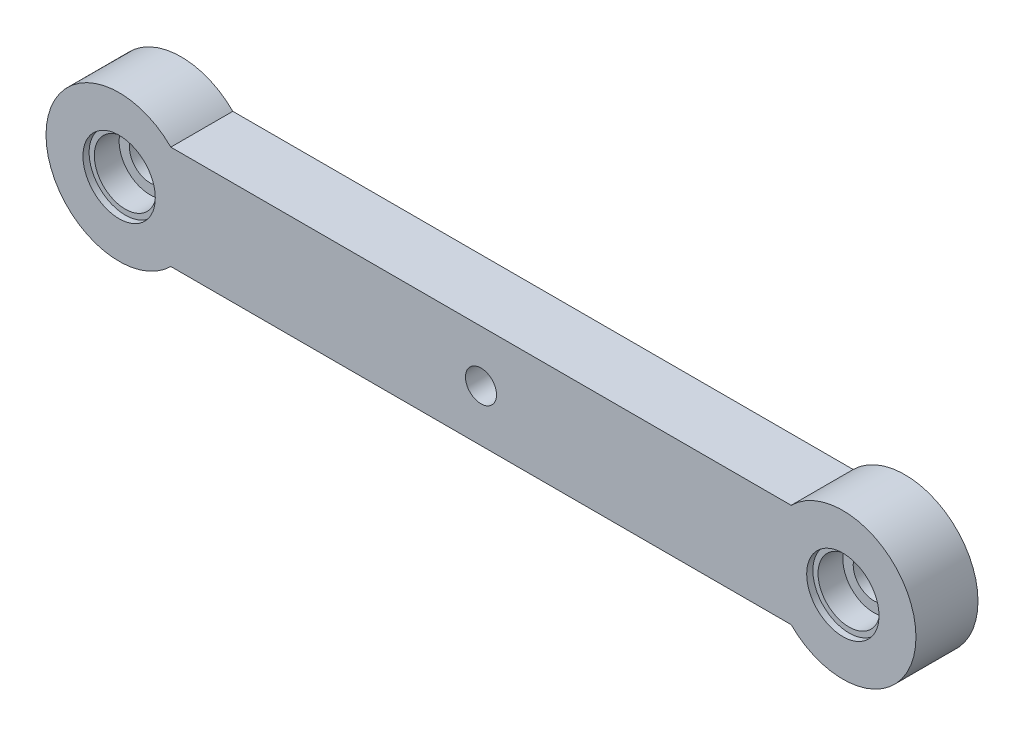
from build123d import *

# Parameters (mm, degrees)
SKETCH1_R               = 7.071067812
SKETCH1_R_2             = 3
SKETCH1_W               = 80
SKETCH1_H               = 10
BOSS_EXTRUDE1_DEPTH     = 6
SKETCH2_R               = 3
CUT_EXTRUDE1_DEPTH      = 3
SKETCH3_R               = 2
CUT_EXTRUDE2_DEPTH      = 44.081025369
SKETCH4_R               = 3.5
CUT_EXTRUDE3_DEPTH      = 0.6
CUT_EXTRUDE4_DEPTH      = 24
CUT_EXTRUDE4_DEPTH_BACK = 44.081025369
SKETCH5_R               = 1.5


with BuildPart() as part:
    # Sketch1 → Boss-Extrude1 (new body)
    with BuildSketch(Plane.XY):
        with Locations((-35, 0)):
            Circle(SKETCH1_R)
        with Locations((-35, 0)):
            Circle(SKETCH1_R_2)
        with Locations((35, 0)):
            Circle(SKETCH1_R)
        with Locations((35, 0)):
            Circle(SKETCH1_R_2)
        Rectangle(SKETCH1_W, SKETCH1_H)
    extrude(amount=BOSS_EXTRUDE1_DEPTH)

    # Sketch2 → Cut-Extrude1 (cut)
    with BuildSketch(Plane.XY.offset(6)):
        with Locations((-35, 0)):
            Circle(SKETCH2_R)
        with Locations((35, 0)):
            Circle(SKETCH2_R)
    extrude(amount=-CUT_EXTRUDE1_DEPTH, mode=Mode.SUBTRACT)

    # Sketch3 → Cut-Extrude2 (cut, through all)
    with BuildSketch(Plane.XY.offset(6)):
        with Locations((-35, 0)):
            Circle(SKETCH3_R)
        with Locations((35, 0)):
            Circle(SKETCH3_R)
    extrude(amount=-CUT_EXTRUDE2_DEPTH, mode=Mode.SUBTRACT)

    # Sketch4 → Cut-Extrude3 (cut)
    with BuildSketch(Plane.XY.offset(6)):
        with Locations((-35, 0)):
            Circle(SKETCH4_R)
        with Locations((35, 0)):
            Circle(SKETCH4_R)
    extrude(amount=-CUT_EXTRUDE3_DEPTH, mode=Mode.SUBTRACT)

    # Sketch5 → Cut-Extrude4 (cut, two sides: drawn at the far end of the back side and taken through both)
    with BuildSketch(Plane.XY.offset(6).offset(-CUT_EXTRUDE4_DEPTH_BACK)):
        Circle(SKETCH5_R)
    extrude(amount=CUT_EXTRUDE4_DEPTH + CUT_EXTRUDE4_DEPTH_BACK, mode=Mode.SUBTRACT)


solid = part.part
